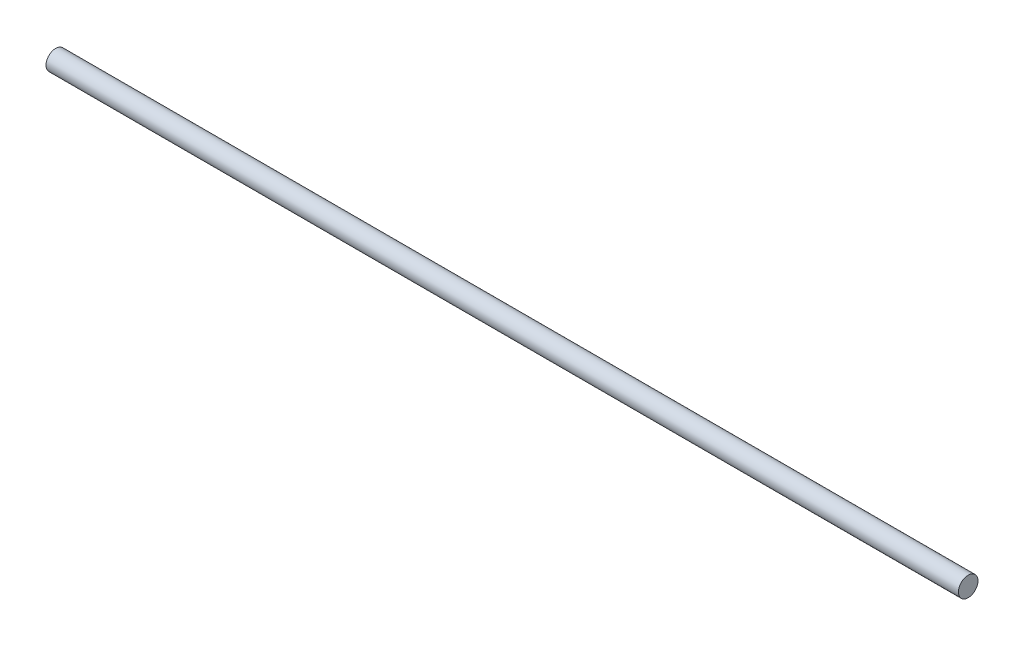
from build123d import *

# Parameters (mm, degrees)
BOSS_EXTRUDE2_DEPTH      = 177.8
BOSS_EXTRUDE2_DEPTH_BACK = 177.8
SKETCH4_R                = 3.81


with BuildPart() as part:
    # Sketch4 → Boss-Extrude2 (new, two sides: drawn at the far end of the back side and taken through both)
    with BuildSketch(Plane(origin=(0, 0, 0), x_dir=(0, 0, -1), z_dir=(1, 0, 0)).offset(-BOSS_EXTRUDE2_DEPTH_BACK)):
        with Locations((57.673059582, 144.175869708)):
            Circle(SKETCH4_R)
    extrude(amount=BOSS_EXTRUDE2_DEPTH + BOSS_EXTRUDE2_DEPTH_BACK)


solid = part.part
